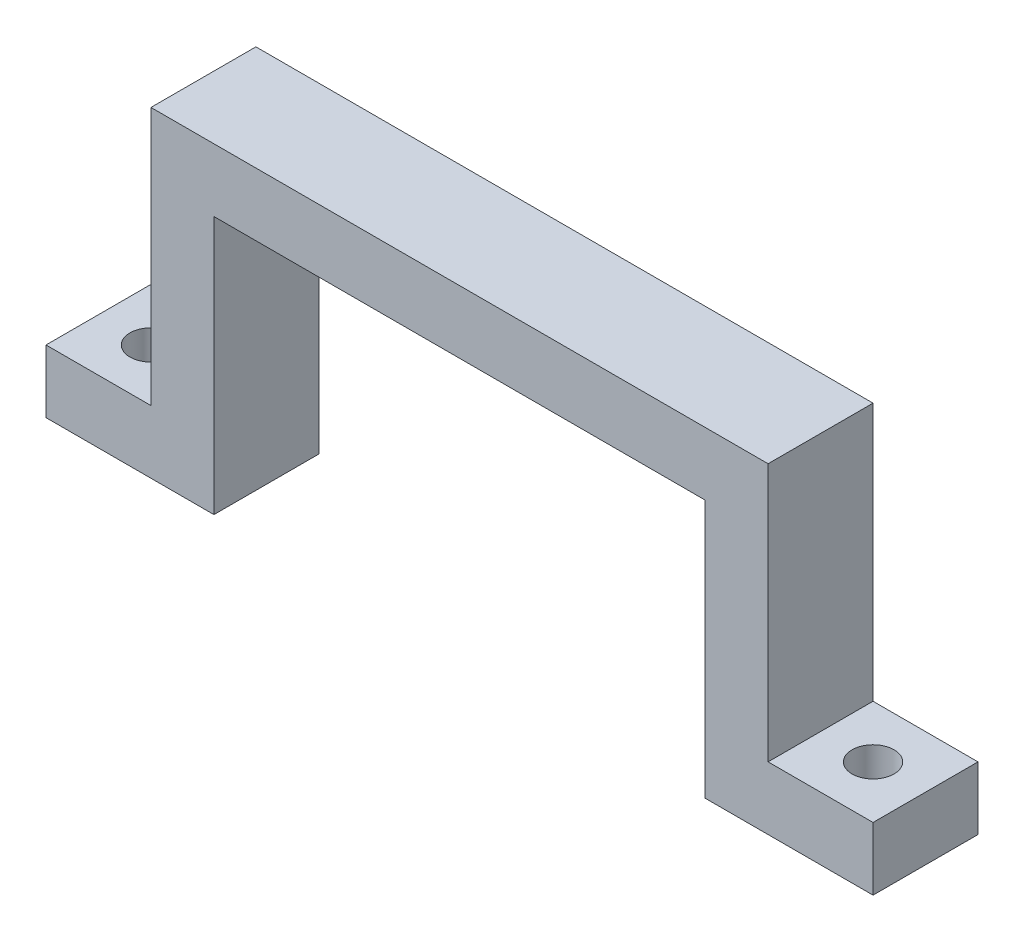
from build123d import *

# Parameters (mm, degrees)
SKETCH1_W           = 29.4
SKETCH1_H           = 5
BOSS_EXTRUDE1_DEPTH = 15.3
CUT_EXTRUDE2_REACH  = 23.799
SKETCH4_W           = 23.4
SKETCH4_H           = 12.3
SKETCH5_W           = 5
SKETCH5_H           = 3
BOSS_EXTRUDE3_DEPTH = 5
CUT_EXTRUDE3_REACH  = 25.359
SKETCH6_R           = 1


with BuildPart() as part:
    # Sketch1 → Boss-Extrude1 (new body)
    with BuildSketch(Plane(origin=(0, 0, 0), x_dir=(1, 0, 0), z_dir=(0, 1, 0))):
        Rectangle(SKETCH1_W, SKETCH1_H)
    extrude(amount=-BOSS_EXTRUDE1_DEPTH)

    # Sketch4 → Cut-Extrude2 (cut, up to next)
    with BuildSketch(Plane.XY.offset(2.5), mode=Mode.PRIVATE) as cut_extrude2_sk1:
        with Locations((0, -9.15)):
            Rectangle(SKETCH4_W, SKETCH4_H)
    cut_extrude2_tool1 = extrude(cut_extrude2_sk1.sketch, amount=-CUT_EXTRUDE2_REACH, mode=Mode.PRIVATE) & part.part
    add(cut_extrude2_tool1.solids().sort_by_distance((0, -9.15, 2.5))[0], mode=Mode.SUBTRACT)

    # Sketch5 → Boss-Extrude3 (add)
    with BuildSketch(Plane(origin=(14.7, 0, 0), x_dir=(0, 0, -1), z_dir=(1, 0, 0))):
        with Locations((0, -13.8)):
            Rectangle(SKETCH5_W, SKETCH5_H)
    boss_extrude3 = extrude(amount=BOSS_EXTRUDE3_DEPTH)

    # Sketch6 → Cut-Extrude3 (cut, up to next)
    with BuildSketch(Plane(origin=(0, -12.3, 0), x_dir=(1, 0, 0), z_dir=(0, 1, 0)), mode=Mode.PRIVATE) as cut_extrude3_sk1:
        with Locations(Location((17.2, 0, 0), (0, 0, 270))):
            Circle(SKETCH6_R)
    cut_extrude3_tool1 = extrude(cut_extrude3_sk1.sketch, amount=-CUT_EXTRUDE3_REACH, mode=Mode.PRIVATE) & part.part
    cut_extrude3 = cut_extrude3_tool1.solids().sort_by_distance((17.2, -12.3, 0))[0]
    add(cut_extrude3, mode=Mode.SUBTRACT)

    # Mirror2: Boss-Extrude3, Cut-Extrude3 across plane
    add(boss_extrude3.mirror(Plane(origin=(0, 0, 0), x_dir=(0, 0, 1), z_dir=(1, 0, 0))))
    add(cut_extrude3.mirror(Plane(origin=(0, 0, 0), x_dir=(0, 0, 1), z_dir=(1, 0, 0))), mode=Mode.SUBTRACT)


solid = part.part
